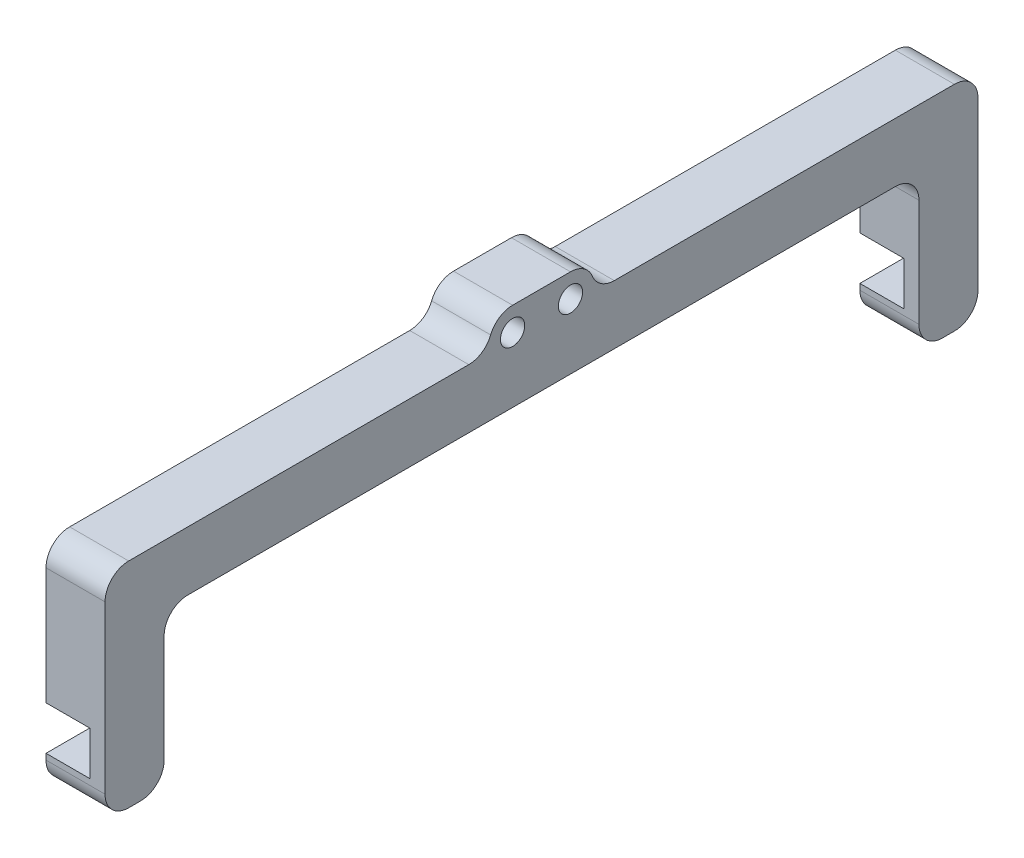
from build123d import *

# Parameters (mm, degrees)
BOSS_EXTRUDE1_DEPTH = 10
SKETCH3_R           = 2.055
CUT_EXTRUDE1_DEPTH  = 85.739837149
SKETCH5_W           = 10
SKETCH5_H           = 13.8
BOSS_EXTRUDE2_DEPTH = 10
SKETCH10_W          = 10
SKETCH10_H          = 7.4
BOSS_EXTRUDE5_DEPTH = 2.52893219
SKETCH11_W          = 10
SKETCH11_H          = 5
BOSS_EXTRUDE6_DEPTH = 10
FILLET1_R           = 4
FILLET2_R           = 4
FILLET3_R           = 4


with BuildPart() as part:
    # Sketch1 → Boss-Extrude1 (new body)
    with BuildSketch(Plane(origin=(0, 0, 0), x_dir=(0, 0, -1), z_dir=(1, 0, 0))):
        Polygon((17.8, -5), (82.8, -5), (82.8, -15), (-65, -15), (-65, -5), (0, -5), (0, 0), (17.8, 0), align=None)
    extrude(amount=BOSS_EXTRUDE1_DEPTH)

    # Sketch3 → Cut-Extrude1 (cut, through all)
    with BuildSketch(Plane(origin=(10, 0, 0), x_dir=(0, 0, -1), z_dir=(1, 0, 0))):
        with Locations((4, -4)):
            Circle(SKETCH3_R)
        with Locations((13.8, -4)):
            Circle(SKETCH3_R)
    extrude(amount=-CUT_EXTRUDE1_DEPTH, mode=Mode.SUBTRACT)

    # Sketch5 → Boss-Extrude2 (add)
    with BuildSketch(Plane(origin=(10, 0, 0), x_dir=(0, 0, -1), z_dir=(1, 0, 0))):
        with Locations((-60, -21.9)):
            Rectangle(SKETCH5_W, SKETCH5_H)
        with Locations((77.8, -21.9)):
            Rectangle(SKETCH5_W, SKETCH5_H)
    extrude(amount=-BOSS_EXTRUDE2_DEPTH)

    # Sketch10 → Boss-Extrude5 (add)
    with BuildSketch(Plane(origin=(10, 0, 0), x_dir=(0, 0, -1), z_dir=(1, 0, 0))):
        with Locations((-60, -32.5)):
            Rectangle(SKETCH10_W, SKETCH10_H)
    boss_extrude5 = extrude(amount=-BOSS_EXTRUDE5_DEPTH)

    # Sketch11 → Boss-Extrude6 (add)
    with BuildSketch(Plane(origin=(10, 0, 0), x_dir=(0, 0, -1), z_dir=(1, 0, 0))):
        with Locations((-60, -38.7)):
            Rectangle(SKETCH11_W, SKETCH11_H)
    boss_extrude6 = extrude(amount=-BOSS_EXTRUDE6_DEPTH)

    # Mirror1: Boss-Extrude5, Boss-Extrude6 across plane
    add(boss_extrude5.mirror(Plane.XY.offset(-8.9)))
    add(boss_extrude6.mirror(Plane.XY.offset(-8.9)))

    # Fillet1
    fillet1_edges = [part.edges().sort_by_distance(p)[0] for p in [
        (5, 0, 0),
        (5, 0, -17.8),
    ]]
    fillet(fillet1_edges, radius=FILLET1_R)

    # Fillet2
    fillet2_edges = [part.edges().sort_by_distance(p)[0] for p in [
        (5, -5, -82.8),
        (5, -5, 65),
        (5, -15, 55),
        (5, -15, -72.8),
        (5, -41.2, 55),
        (5, -41.2, 65),
        (5, -41.2, -82.8),
        (5, -41.2, -72.8),
    ]]
    fillet(fillet2_edges, radius=FILLET2_R)

    # Fillet3
    fillet3_edges = [part.edges().sort_by_distance(p)[0] for p in [
        (5, -5, -17.8),
        (5, -5, 0),
    ]]
    fillet(fillet3_edges, radius=FILLET3_R)


solid = part.part
